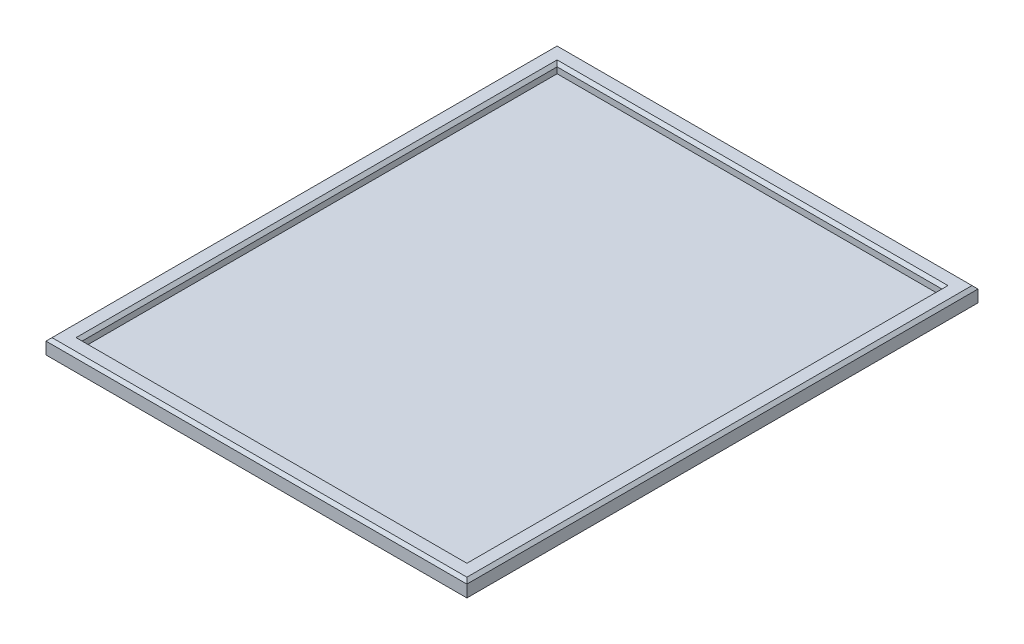
from build123d import *

# Parameters (mm, degrees)
SKETCH3_W           = 700
SKETCH3_H           = 850
SKETCH3_W_2         = 640
SKETCH3_H_2         = 790
BOSS_EXTRUDE1_DEPTH = 30
CHAMFER2_SIZE       = 5
SKETCH4_W           = 640
SKETCH4_H           = 790
BOSS_EXTRUDE2_DEPTH = 15


with BuildPart() as part:
    # Sketch3 → Boss-Extrude1 (new body)
    with BuildSketch(Plane(origin=(0, 0, 0), x_dir=(1, 0, 0), z_dir=(0, 1, 0))):
        Rectangle(SKETCH3_W, SKETCH3_H)
        Rectangle(SKETCH3_W_2, SKETCH3_H_2, mode=Mode.SUBTRACT)
    extrude(amount=BOSS_EXTRUDE1_DEPTH)

    # Chamfer2
    chamfer2_edges = [part.edges().sort_by_distance(p)[0] for p in [
        (-350, 30, 0),
        (-320, 30, 0),
        (0, 30, 425),
        (0, 30, 395),
        (320, 30, 0),
        (0, 30, -395),
        (350, 30, 0),
        (0, 0, 425),
        (-350, 0, 0),
        (0, 0, -425),
        (350, 0, 0),
        (0, 30, -425),
    ]]
    chamfer(chamfer2_edges, length=CHAMFER2_SIZE)


with BuildPart() as body_2:
    # Sketch4 → Boss-Extrude2 (new body)
    with BuildSketch(Plane.XZ):
        Rectangle(SKETCH4_W, SKETCH4_H)
    extrude(amount=-BOSS_EXTRUDE2_DEPTH)


solid = Compound([part.part, body_2.part])
